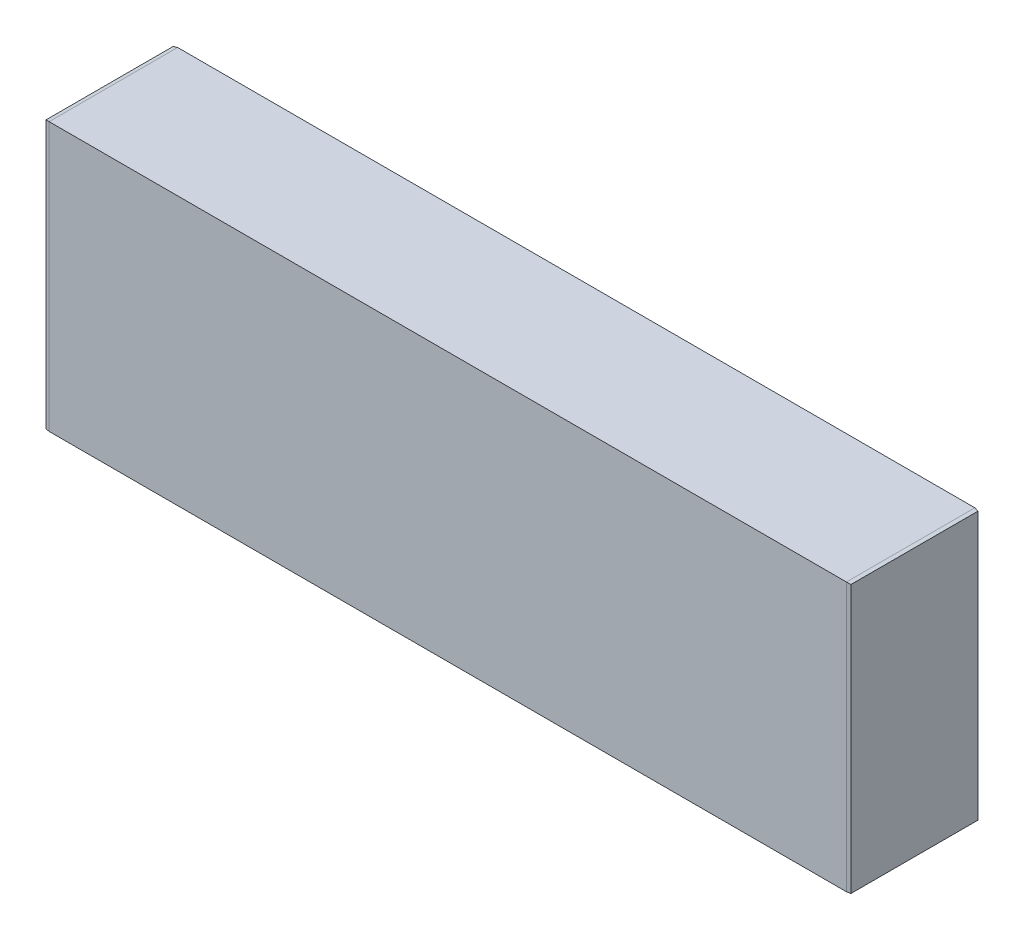
from build123d import *
from OCP.BRepFilletAPI import BRepFilletAPI_MakeChamfer

# Parameters (mm, degrees)
SKETCH1_W           = 213
SKETCH1_H           = 71
BOSS_EXTRUDE1_DEPTH = 34
CHAMFER1_SIZE       = 1
CHAMFER1_SIZE2      = 0.176326981
CHAMFER2_SIZE       = 1
CHAMFER2_SIZE2      = 0.176326981
SKETCH3_W           = 23.647346038
SKETCH3_H           = 16.197572193
SKETCH3_W_2         = 4
SKETCH3_H_2         = 13.380603116
SKETCH3_H_3         = 13.392122804
SKETCH3_H_4         = 13.411553204
SKETCH3_H_5         = 13.439263392
CUT_EXTRUDE2_DEPTH  = 1
SKETCH4_W           = 6
SKETCH4_H           = 1
CUT_EXTRUDE3_DEPTH  = 1


with BuildPart() as part:
    # Sketch1 → Boss-Extrude1 (new body)
    with BuildSketch(Plane.XY):
        with Locations((61.169898141, -8.554853616)):
            Rectangle(SKETCH1_W, SKETCH1_H)
    extrude(amount=BOSS_EXTRUDE1_DEPTH)

    # Chamfer1: one chamfer whose edges measure the first distance from different faces: ONE call of the kernel's chamfer builder (chamfer() names one face for all edges)
    chamfer1_edges_1 = [part.edges().sort_by_distance(p)[0] for p in [
        (-45.330101859, -8.554853616, 34),
    ]]
    chamfer1_side_1 = [part.faces().sort_by_distance(p)[0] for p in [
        (61.169898141, -8.554853616, 34),
    ]]
    chamfer1_edges_2 = [part.edges().sort_by_distance(p)[0] for p in [
        (-45.330101859, -8.554853616, 0),
    ]]
    chamfer1_side_2 = [part.faces().sort_by_distance(p)[0] for p in [
        (61.169898141, -8.554853616, 0),
    ]]
    chamfer1_edges_3 = [part.edges().sort_by_distance(p)[0] for p in [
        (-45.330101859, 26.945146384, 17),
    ]]
    chamfer1_side_3 = [part.faces().sort_by_distance(p)[0] for p in [
        (61.169898141, 26.945146384, 17),
    ]]
    chamfer1 = BRepFilletAPI_MakeChamfer(part.part.solid().wrapped)
    for e in chamfer1_edges_1:
        chamfer1.Add(CHAMFER1_SIZE, CHAMFER1_SIZE2, e.wrapped, chamfer1_side_1[0].wrapped)  # the first distance lies on this face
    for e in chamfer1_edges_2:
        chamfer1.Add(CHAMFER1_SIZE, CHAMFER1_SIZE2, e.wrapped, chamfer1_side_2[0].wrapped)  # the first distance lies on this face
    for e in chamfer1_edges_3:
        chamfer1.Add(CHAMFER1_SIZE, CHAMFER1_SIZE2, e.wrapped, chamfer1_side_3[0].wrapped)  # the first distance lies on this face
    add(Compound.cast(chamfer1.Shape()), mode=Mode.REPLACE)

    # Chamfer2: one chamfer whose edges measure the first distance from different faces: ONE call of the kernel's chamfer builder (chamfer() names one face for all edges)
    chamfer2_edges_1 = [part.edges().sort_by_distance(p)[0] for p in [
        (167.669898141, -8.554853616, 34),
    ]]
    chamfer2_side_1 = [part.faces().sort_by_distance(p)[0] for p in [
        (61.669898141, -8.554853616, 34),
    ]]
    chamfer2_edges_2 = [part.edges().sort_by_distance(p)[0] for p in [
        (167.669898141, -8.554853616, 0),
    ]]
    chamfer2_side_2 = [part.faces().sort_by_distance(p)[0] for p in [
        (61.669898141, -8.554853616, 0),
    ]]
    chamfer2_edges_3 = [part.edges().sort_by_distance(p)[0] for p in [
        (167.669898141, 26.945146384, 17),
    ]]
    chamfer2_side_3 = [part.faces().sort_by_distance(p)[0] for p in [
        (61.669898141, 26.945146384, 17),
    ]]
    chamfer2 = BRepFilletAPI_MakeChamfer(part.part.solid().wrapped)
    for e in chamfer2_edges_1:
        chamfer2.Add(CHAMFER2_SIZE, CHAMFER2_SIZE2, e.wrapped, chamfer2_side_1[0].wrapped)  # the first distance lies on this face
    for e in chamfer2_edges_2:
        chamfer2.Add(CHAMFER2_SIZE, CHAMFER2_SIZE2, e.wrapped, chamfer2_side_2[0].wrapped)  # the first distance lies on this face
    for e in chamfer2_edges_3:
        chamfer2.Add(CHAMFER2_SIZE, CHAMFER2_SIZE2, e.wrapped, chamfer2_side_3[0].wrapped)  # the first distance lies on this face
    add(Compound.cast(chamfer2.Shape()), mode=Mode.REPLACE)

    # Sketch3 → Cut-Extrude2 (cut)
    with BuildSketch(Plane.ZY.offset(45.330101859)):
        with Locations((17, -25.758486194)):
            Rectangle(SKETCH3_W, SKETCH3_H)
        with Locations((8.705796188, -25.859092232)):
            Rectangle(SKETCH3_W_2, SKETCH3_H_2, mode=Mode.SUBTRACT)
        with Locations((14.235265396, -25.864852076)):
            Rectangle(SKETCH3_W_2, SKETCH3_H_3, mode=Mode.SUBTRACT)
        with Locations((19.764734604, -25.874567276)):
            Rectangle(SKETCH3_W_2, SKETCH3_H_4, mode=Mode.SUBTRACT)
        with Locations((25.294203812, -25.88842237)):
            Rectangle(SKETCH3_W_2, SKETCH3_H_5, mode=Mode.SUBTRACT)
    extrude(amount=-CUT_EXTRUDE2_DEPTH, mode=Mode.SUBTRACT)

    # Sketch4 → Cut-Extrude3 (cut)
    with BuildSketch(Plane.ZY.offset(45.330101859)):
        Polygon((8.176326981, -35.85727229), (9.176326981, -35.85727229), (9.176326981, -38.35727229), (11.676326981, -38.35727229), (11.676326981, -39.35727229), (9.176326981, -39.35727229), (9.176326981, -41.85727229), (8.176326981, -41.85727229), (8.176326981, -39.35727229), (5.676326981, -39.35727229), (5.676326981, -38.35727229), (8.176326981, -38.35727229), align=None)
        with Locations((25.720428724, -38.85727229)):
            Rectangle(SKETCH4_W, SKETCH4_H)
    extrude(amount=-CUT_EXTRUDE3_DEPTH, mode=Mode.SUBTRACT)


solid = part.part
